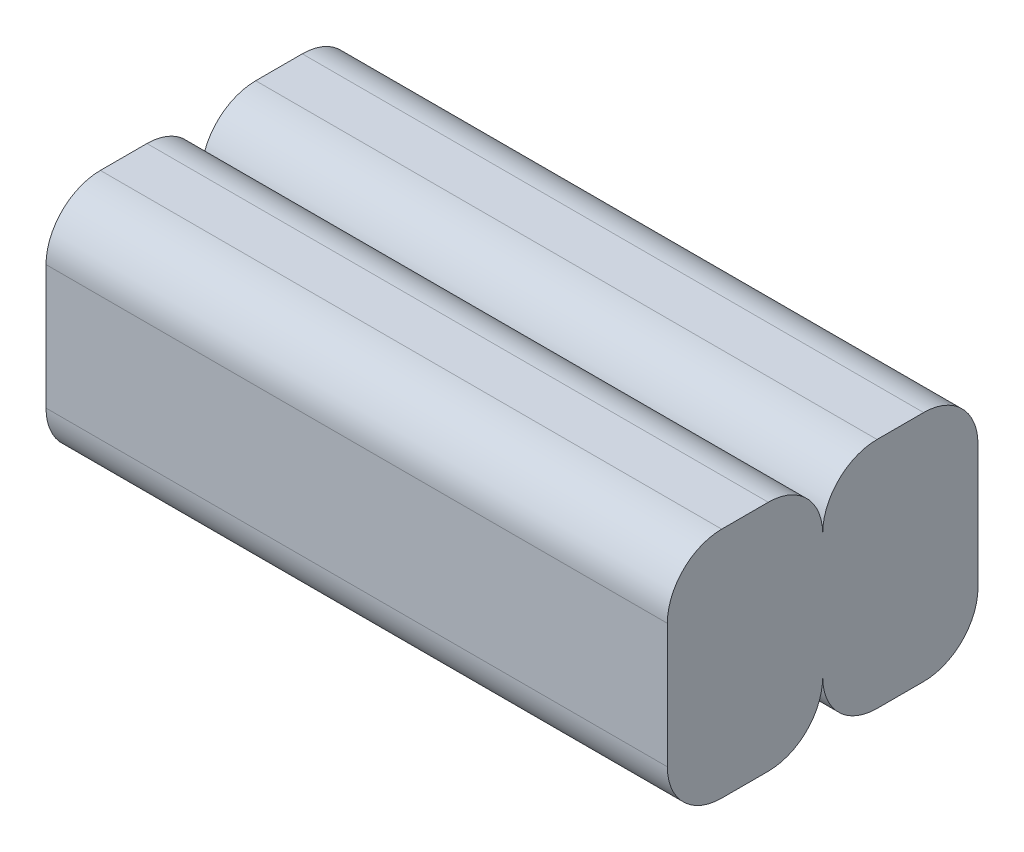
from build123d import *

# Parameters (mm, degrees)
EXTRUDE_1_DEPTH = 80
FILLET_1_R      = 7
FILLET_2_R      = 7
FILLET_3_R      = 7
FILLET_4_R      = 7


with BuildPart() as part:
    # 草图1 → 凸台-拉伸1 (new body)
    with BuildSketch(Plane(origin=(0, 0, 0), x_dir=(0, 0, -1), z_dir=(1, 0, 0))):
        with BuildLine():
            Line((20, -15), (7, -15))
            ThreePointArc((7, -15), (2.050252532, -12.949747468), (0, -8))
            ThreePointArc((0, -8), (-2.050252532, -12.949747468), (-7, -15))
            Line((-7, -15), (-20, -15))
            Line((-20, -15), (-20, 15))
            Line((-20, 15), (-7, 15))
            ThreePointArc((-7, 15), (-2.050252532, 12.949747468), (0, 8))
            ThreePointArc((0, 8), (2.050252532, 12.949747468), (7, 15))
            Line((7, 15), (20, 15))
            Line((20, 15), (20, -15))
        make_face()
    extrude(amount=EXTRUDE_1_DEPTH)

    # 圆角1
    fillet_1_edges = [part.edges().sort_by_distance(p)[0] for p in [
        (40, 15, -20),
    ]]
    fillet(fillet_1_edges, radius=FILLET_1_R)

    # 圆角2
    fillet_2_edges = [part.edges().sort_by_distance(p)[0] for p in [
        (40, 15, 20),
    ]]
    fillet(fillet_2_edges, radius=FILLET_2_R)

    # 圆角3
    fillet_3_edges = [part.edges().sort_by_distance(p)[0] for p in [
        (40, -15, -20),
    ]]
    fillet(fillet_3_edges, radius=FILLET_3_R)

    # 圆角4
    fillet_4_edges = [part.edges().sort_by_distance(p)[0] for p in [
        (40, -15, 20),
    ]]
    fillet(fillet_4_edges, radius=FILLET_4_R)


solid = part.part
